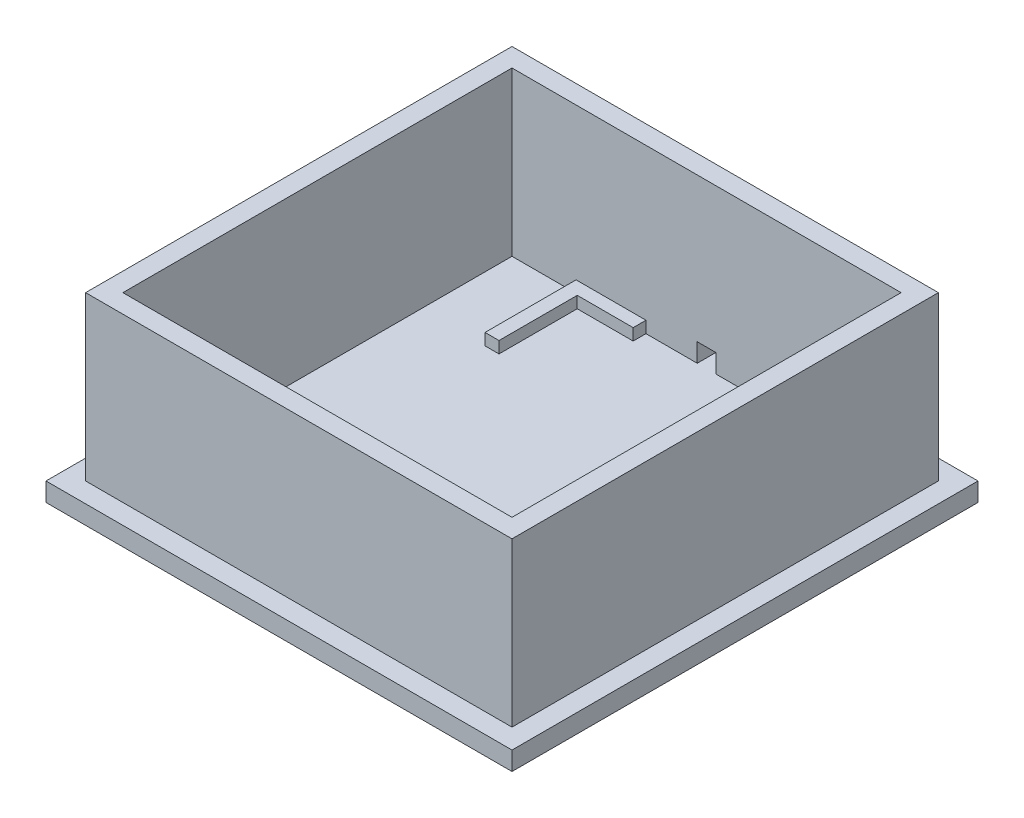
from build123d import *

# Parameters (mm, degrees)
SKETCH1_W           = 100
SKETCH1_H           = 100
BOSS_EXTRUDE1_DEPTH = 4
SKETCH2_W           = 91.5
SKETCH2_H           = 91.5
SKETCH2_W_2         = 83.5
SKETCH2_H_2         = 83.5
BOSS_EXTRUDE2_DEPTH = 35
SKETCH3_W           = 4
SKETCH3_H           = 4
CUT_EXTRUDE1_DEPTH  = 4
BOSS_EXTRUDE3_DEPTH = 2.5


with BuildPart() as part:
    # Sketch1 → Boss-Extrude1 (new body)
    with BuildSketch(Plane(origin=(0, 0, 0), x_dir=(1, 0, 0), z_dir=(0, 1, 0))):
        Rectangle(SKETCH1_W, SKETCH1_H)
    extrude(amount=BOSS_EXTRUDE1_DEPTH)

    # Sketch2 → Boss-Extrude2 (add)
    with BuildSketch(Plane(origin=(0, 4, 0), x_dir=(1, 0, 0), z_dir=(0, 1, 0))):
        Rectangle(SKETCH2_W, SKETCH2_H)
        Rectangle(SKETCH2_W_2, SKETCH2_H_2, mode=Mode.SUBTRACT)
    extrude(amount=BOSS_EXTRUDE2_DEPTH)

    # Sketch3 → Cut-Extrude1 (cut)
    with BuildSketch(Plane(origin=(0, 0, -45.75), x_dir=(-1, 0, 0), z_dir=(0, 0, -1))):
        with Locations((0, 6)):
            Rectangle(SKETCH3_W, SKETCH3_H)
    extrude(amount=-CUT_EXTRUDE1_DEPTH, mode=Mode.SUBTRACT)

    # Sketch4 → Boss-Extrude3 (add)
    with BuildSketch(Plane(origin=(0, 4, 0), x_dir=(1, 0, 0), z_dir=(0, 1, 0))):
        Polygon((-28, 22.21), (-25, 22.21), (-25, 39), (-13, 39), (-13, 41.75), (-28, 41.75), align=None)
        Polygon((25, 39), (25, 22.21), (28, 22.21), (28, 41.75), (13, 41.75), (13, 39), align=None)
        Polygon((25, -39), (13, -39), (13, -41.75), (28, -41.75), (28, -22.21), (25, -22.21), align=None)
        Polygon((-13, -39), (-25, -39), (-25, -22.21), (-28, -22.21), (-28, -41.75), (-13, -41.75), align=None)
    extrude(amount=BOSS_EXTRUDE3_DEPTH)


solid = part.part
